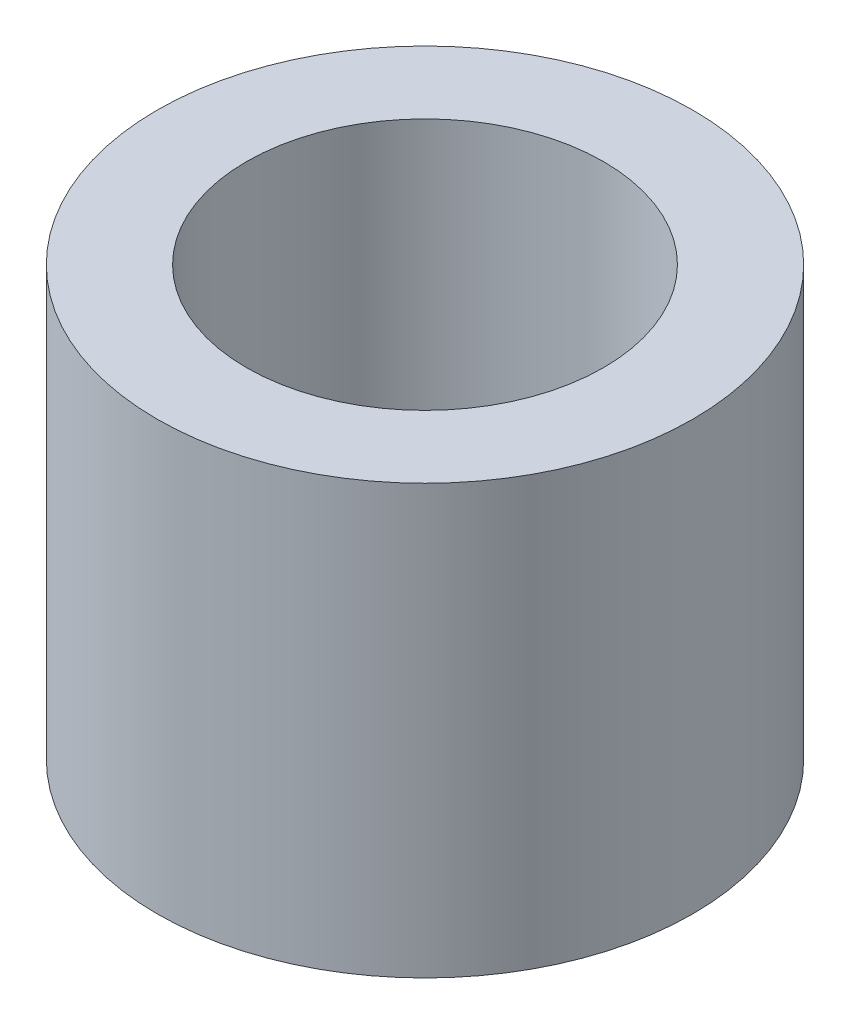
from build123d import *

# Parameters (mm, degrees)
SKETCH2_R           = 7.5
SKETCH2_R_2         = 5
BOSS_EXTRUDE1_DEPTH = 12


with BuildPart() as part:
    # Sketch2 → Boss-Extrude1 (new body)
    with BuildSketch(Plane(origin=(0, 0, 0), x_dir=(1, 0, 0), z_dir=(0, 1, 0))):
        with Locations(Location((0, 0, 0), (0, 0, 270))):
            Circle(SKETCH2_R)
        with Locations(Location((0, 0, 0), (0, 0, 270))):
            Circle(SKETCH2_R_2, mode=Mode.SUBTRACT)
    extrude(amount=BOSS_EXTRUDE1_DEPTH)


solid = part.part
